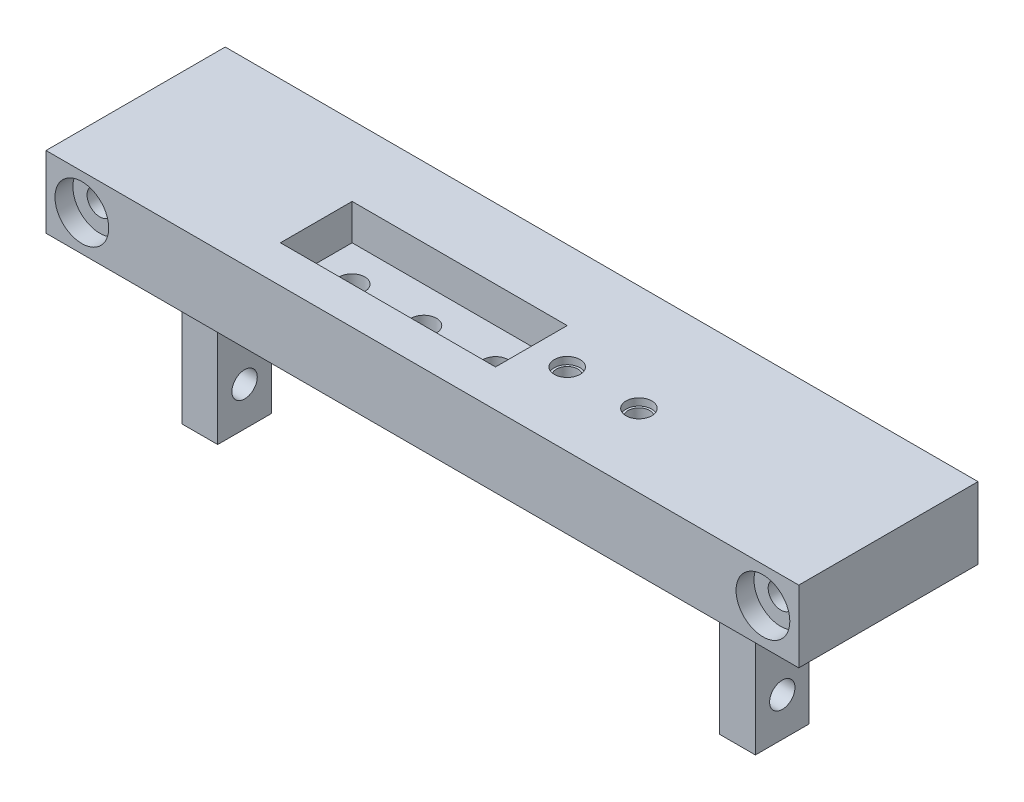
from build123d import *

# Parameters (mm, degrees)
SKETCH1_W                                           = 133.35
SKETCH1_H                                           = 31.75
BOSS_EXTRUDE1_DEPTH                                 = 12.7
CBORE_FOR_8_BINDING_HEAD_MACHINE_SCREW1_D           = 4.4958
CBORE_FOR_8_BINDING_HEAD_MACHINE_SCREW1_CBORE_D     = 9.525
CBORE_FOR_8_BINDING_HEAD_MACHINE_SCREW1_CBORE_DEPTH = 3.175
F_8_0_199_DIAMETER_HOLE1_D                          = 4.4958
SKETCH6_W                                           = 6.35
SKETCH6_H                                           = 9.525
BOSS_EXTRUDE2_DEPTH                                 = 25.4
F_8_0_199_DIAMETER_HOLE2_D                          = 4.4958
CBORE_FOR_6_BINDING_HEAD_MACHINE_SCREW1_D           = 3.7973
CBORE_FOR_6_BINDING_HEAD_MACHINE_SCREW1_CBORE_D     = 7.9375
CBORE_FOR_6_BINDING_HEAD_MACHINE_SCREW1_CBORE_DEPTH = 6.35
SKETCH12_R                                          = 2.286
CUT_EXTRUDE1_DEPTH                                  = 1.27
CUT_EXTRUDE2_START                                  = -6.35
SKETCH13_R                                          = 2.2479
CUT_EXTRUDE2_DEPTH                                  = 6.35
F_8_0_199_DIAMETER_HOLE3_D                          = 4.4958


with BuildPart() as part:
    # Sketch1 → Boss-Extrude1 (new body)
    with BuildSketch(Plane(origin=(0, 0, 0), x_dir=(1, 0, 0), z_dir=(0, 1, 0))):
        with Locations((66.675, 15.875)):
            Rectangle(SKETCH1_W, SKETCH1_H)
    extrude(amount=BOSS_EXTRUDE1_DEPTH)

    # CBORE for #8 Binding Head Machine Screw1 (through all)
    with Locations(Plane.XY):
        with Locations((6.35, 6.35), (127, 6.35)):
            CounterBoreHole(CBORE_FOR_8_BINDING_HEAD_MACHINE_SCREW1_D / 2, CBORE_FOR_8_BINDING_HEAD_MACHINE_SCREW1_CBORE_D / 2, CBORE_FOR_8_BINDING_HEAD_MACHINE_SCREW1_CBORE_DEPTH)

    # #8 (0.199) Diameter Hole1 (through all)
    with Locations(Plane(origin=(0, 12.7, 0), x_dir=(1, 0, 0), z_dir=(0, 1, 0))):
        with Locations((66.675, 12.954)):
            Hole(F_8_0_199_DIAMETER_HOLE1_D / 2)

    # Sketch6 → Boss-Extrude2 (add)
    with BuildSketch(Plane.XZ):
        with Locations((114.3, -12.954)):
            Rectangle(SKETCH6_W, SKETCH6_H)
        with Locations((19.05, -12.954)):
            Rectangle(SKETCH6_W, SKETCH6_H)
    extrude(amount=BOSS_EXTRUDE2_DEPTH)

    # #8 (0.199) Diameter Hole2 (through all)
    with Locations(Plane(origin=(117.475, 0, 0), x_dir=(0, 0, -1), z_dir=(1, 0, 0))):
        with Locations((12.954, -5.842), (12.954, -18.542)):
            Hole(F_8_0_199_DIAMETER_HOLE2_D / 2)

    # CBORE for #6 Binding Head Machine Screw1 (through all)
    with Locations(Plane(origin=(0, 0, 0), x_dir=(-1, 0, 0), z_dir=(0, -1, 0))):
        with Locations((-79.375, 12.954), (-92.075, 12.954)):
            CounterBoreHole(CBORE_FOR_6_BINDING_HEAD_MACHINE_SCREW1_D / 2, CBORE_FOR_6_BINDING_HEAD_MACHINE_SCREW1_CBORE_D / 2, CBORE_FOR_6_BINDING_HEAD_MACHINE_SCREW1_CBORE_DEPTH)

    # Sketch12 → Cut-Extrude1 (cut)
    with BuildSketch(Plane(origin=(0, 12.7, 0), x_dir=(1, 0, 0), z_dir=(0, 1, 0))):
        with Locations(Location((79.375, 12.954, 0), (0, 0, 270))):
            Circle(SKETCH12_R)
        with Locations(Location((92.075, 12.954, 0), (0, 0, 270))):
            Circle(SKETCH12_R)
    extrude(amount=-CUT_EXTRUDE1_DEPTH, mode=Mode.SUBTRACT)

    # Sketch13 → Cut-Extrude2 (cut)
    with BuildSketch(Plane(origin=(0, 12.7, 0), x_dir=(1, 0, 0), z_dir=(0, 1, 0)).offset(CUT_EXTRUDE2_START)):
        with Locations(Location((66.675, 12.954, 0), (0, 0, 270))):
            Circle(SKETCH13_R)
        Polygon((34.925, 6.604), (66.675, 6.604), (66.675, 12.954), (66.675, 19.304), (34.925, 19.304), align=None)
        Polygon((73.025, 6.604), (66.675, 6.604), (66.675, 12.954), (66.675, 19.304), (73.025, 19.304), align=None)
    extrude(amount=CUT_EXTRUDE2_DEPTH, mode=Mode.SUBTRACT)

    # #8 (0.199) Diameter Hole3 (through all)
    with Locations(Plane(origin=(0, 6.35, 0), x_dir=(1, 0, 0), z_dir=(0, 1, 0))):
        with Locations((53.975, 12.954), (41.275, 12.954)):
            Hole(F_8_0_199_DIAMETER_HOLE3_D / 2)


solid = part.part
